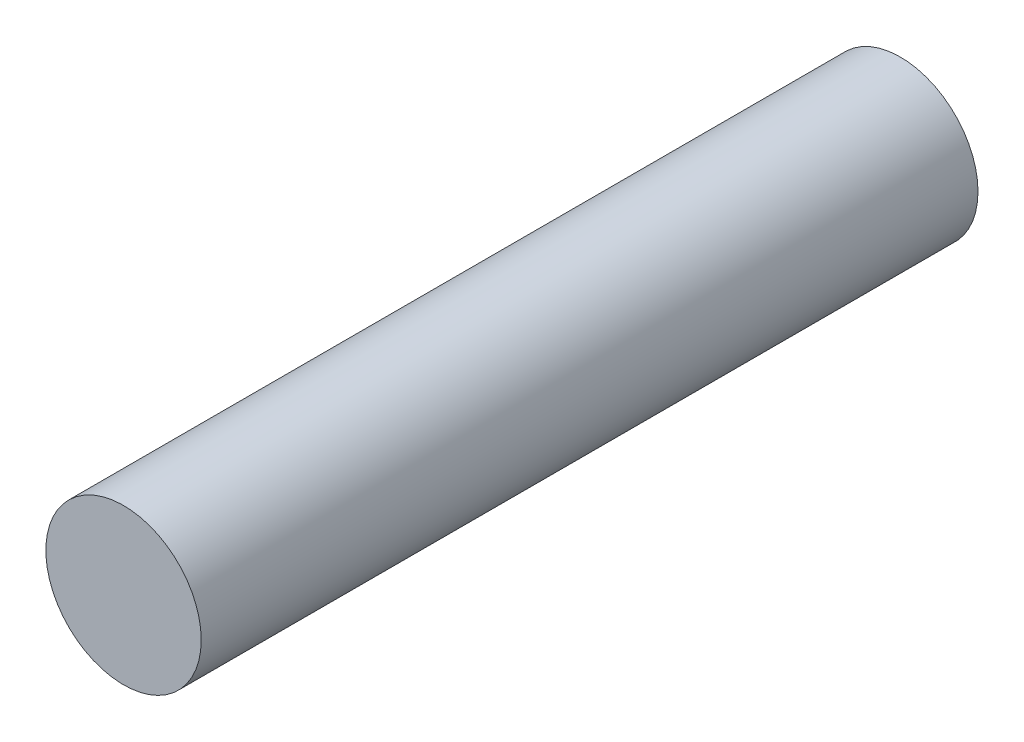
from build123d import *

# Parameters (mm, degrees)
SKETCH_2_R          = 8
EXTRUDE_1_DEPTH     = 80
SKETCH_2_3_R        = 4
CUT_EXTRUDE_1_DEPTH = 30


with BuildPart() as part:
    # 스케치2 → 보스-돌출1 (new body)
    with BuildSketch(Plane.XY):
        Circle(SKETCH_2_R)
    extrude(amount=EXTRUDE_1_DEPTH)

    # 스케치2<3> → 컷-돌출1 (cut)
    with BuildSketch(Plane.XY):
        Circle(SKETCH_2_3_R)
    extrude(amount=CUT_EXTRUDE_1_DEPTH, mode=Mode.SUBTRACT)


solid = part.part
